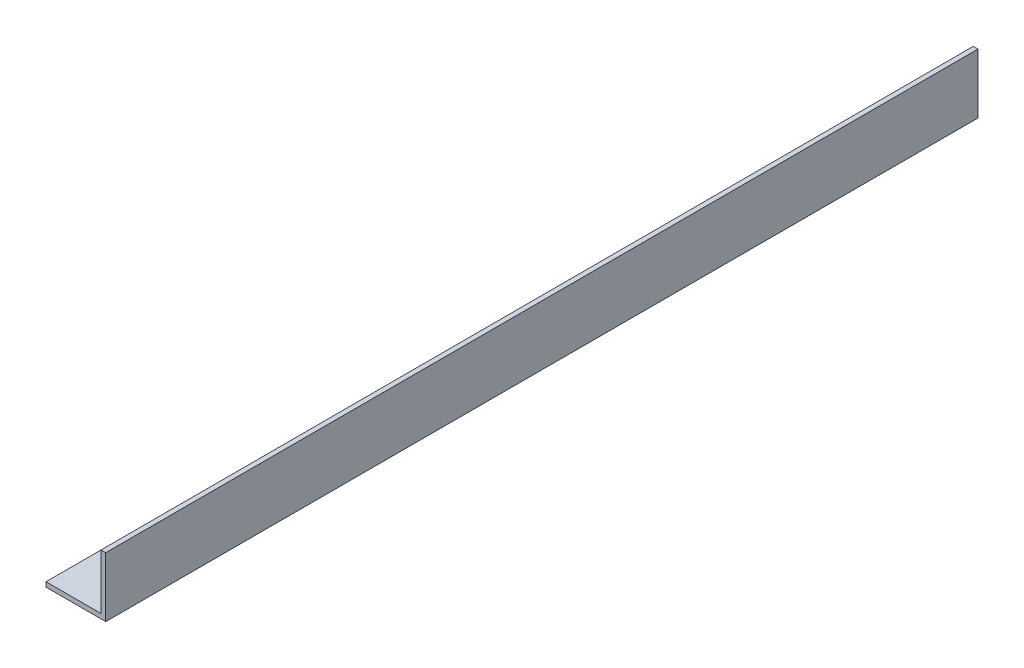
from build123d import *

# Parameters (mm, degrees)
EXTRUDE_THIN1_DEPTH = 371


with BuildPart() as part:
    # Sketch1 → Extrude-Thin1 (new body)
    with BuildSketch(Plane.XY):
        Polygon((0, 25.4), (0, 0), (-25.4, 0), (-25.4, 2), (-2, 2), (-2, 25.4), align=None)
    extrude(amount=EXTRUDE_THIN1_DEPTH)


solid = part.part
